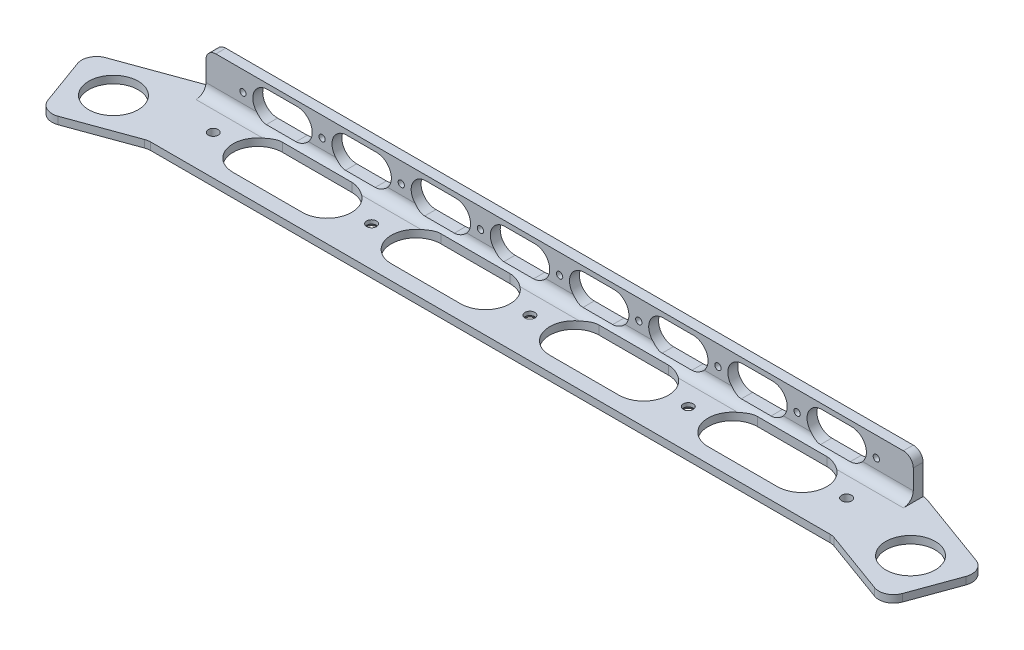
from build123d import *

# Parameters (mm, degrees)
BOSS_EXTRUDE1_DEPTH                                = 4.7752
SKETCH2_R                                          = 3.175
CUT_EXTRUDE1_DEPTH                                 = 291.109415024
SKETCH3_W                                          = 453.840971018
SKETCH3_H                                          = 6.35
BOSS_EXTRUDE2_DEPTH                                = 25.4
FILLET1_R                                          = 6.35
F_10_32_TAPPED_HOLE1_D                             = 4.0386
F_10_32_TAPPED_HOLE1_DEPTH                         = 66.771350159
LPATTERN1_COUNT                                    = 5
LPATTERN1_PITCH                                    = 50.8
LPATTERN1_COL_COUNT                                = 5
LPATTERN1_COL_PITCH                                = 50.8
CUT_EXTRUDE2_REACH                                 = 296.837
LPATTERN2_COUNT                                    = 8
LPATTERN2_PITCH                                    = 50.8
FILLET2_R                                          = 6.35
CUT_EXTRUDE3_REACH                                 = 293.635
SKETCH10_R                                         = 15.875
CSK_FOR_10_FLAT_HEAD_SOCKET_CAP_SCREW1_D           = 5.1054
CSK_FOR_10_FLAT_HEAD_SOCKET_CAP_SCREW1_CSINK_D     = 10.4394
CSK_FOR_10_FLAT_HEAD_SOCKET_CAP_SCREW1_CSINK_ANGLE = 82
CUT_EXTRUDE4_REACH                                 = 293.635
LPATTERN3_COUNT                                    = 4
LPATTERN3_PITCH                                    = 101.6


with BuildPart() as part:
    # Sketch1 → Boss-Extrude1 (new body)
    with BuildSketch(Plane(origin=(0, 0, 0), x_dir=(1, 0, 0), z_dir=(0, 1, 0))):
        with BuildLine():
            Line((-230.178227374, 50.225572213), (-279.319909207, 32.339462764))
            ThreePointArc((-279.319909207, 32.339462764), (-284.694749013, 27.414329494), (-285.012739555, 20.131148686))
            Line((-285.012739555, 20.131148686), (-274.153600004, -9.704092024))
            ThreePointArc((-274.153600004, -9.704092024), (-269.228466734, -15.07893183), (-261.945285926, -15.396922372))
            Line((-261.945285926, -15.396922372), (-221.220816754, -0.574427787))
            ThreePointArc((-221.220816754, -0.574427787), (-219.617073781, -0.144706153), (-217.963074889, 0))
            Line((-217.963074889, 0), (217.963074889, 0))
            ThreePointArc((217.963074889, 0), (219.617073781, -0.144706153), (221.220816754, -0.574427787))
            Line((221.220816754, -0.574427787), (261.945285926, -15.396922372))
            ThreePointArc((261.945285926, -15.396922372), (269.228466734, -15.07893183), (274.153600004, -9.704092024))
            Line((274.153600004, -9.704092024), (285.012739555, 20.131148686))
            ThreePointArc((285.012739555, 20.131148686), (284.694749013, 27.414329494), (279.319909207, 32.339462764))
            Line((279.319909207, 32.339462764), (230.178227374, 50.225572213))
            ThreePointArc((230.178227374, 50.225572213), (228.574484401, 50.655293847), (226.920485509, 50.8))
            Line((226.920485509, 50.8), (-226.920485509, 50.8))
            ThreePointArc((-226.920485509, 50.8), (-228.574484401, 50.655293847), (-230.178227374, 50.225572213))
        make_face()
    extrude(amount=BOSS_EXTRUDE1_DEPTH)

    # Sketch2 → Cut-Extrude1 (cut, through all)
    with BuildSketch(Plane(origin=(0, 4.7752, 0), x_dir=(1, 0, 0), z_dir=(0, 1, 0))):
        with Locations(Location((0, 25.4, 0), (0, 0, 270))):
            Circle(SKETCH2_R)
        with Locations(Location((-101.6, 25.4, 0), (0, 0, 270))):
            Circle(SKETCH2_R)
        with Locations(Location((101.6, 25.4, 0), (0, 0, 270))):
            Circle(SKETCH2_R)
        with Locations(Location((203.2, 25.4, 0), (0, 0, 270))):
            Circle(SKETCH2_R)
        with Locations(Location((-203.2, 25.4, 0), (0, 0, 270))):
            Circle(SKETCH2_R)
    extrude(amount=-CUT_EXTRUDE1_DEPTH, mode=Mode.SUBTRACT)

    # Sketch3 → Boss-Extrude2 (add)
    with BuildSketch(Plane(origin=(0, 4.7752, 0), x_dir=(1, 0, 0), z_dir=(0, 1, 0))):
        with Locations((0, 47.625)):
            Rectangle(SKETCH3_W, SKETCH3_H)
    extrude(amount=BOSS_EXTRUDE2_DEPTH)

    # Fillet1
    fillet1_edges = [part.edges().sort_by_distance(p)[0] for p in [
        (0, 4.7752, -44.45),
    ]]
    fillet(fillet1_edges, radius=FILLET1_R)

    # #10-32 Tapped Hole1
    with Locations(Plane(origin=(0, 0, -50.8), x_dir=(-1, 0, 0), z_dir=(0, 0, -1))):
        with Locations((0, 17.4625)):
            f_10_32_tapped_hole1 = Hole(F_10_32_TAPPED_HOLE1_D / 2, depth=F_10_32_TAPPED_HOLE1_DEPTH)

    # LPattern1: #10-32 Tapped Hole1 ×5
    with Locations(*[(-i * LPATTERN1_PITCH, 0, 0) for i in range(1, LPATTERN1_COUNT)]):
        add(f_10_32_tapped_hole1, mode=Mode.SUBTRACT)

    # LPattern1 col: #10-32 Tapped Hole1 ×5
    with Locations(*[(i * LPATTERN1_COL_PITCH, 0, 0) for i in range(1, LPATTERN1_COL_COUNT)]):
        add(f_10_32_tapped_hole1, mode=Mode.SUBTRACT)

    # Sketch9 → Cut-Extrude2 (cut, up to next)
    with BuildSketch(Plane(origin=(0, 0, -50.8), x_dir=(-1, 0, 0), z_dir=(0, 0, -1)), mode=Mode.PRIVATE) as cut_extrude2_sk1:
        with BuildLine():
            Line((168.275, 26.9875), (187.325, 26.9875))
            ThreePointArc((187.325, 26.9875), (196.85, 17.4625), (187.325, 7.9375))
            Line((187.325, 7.9375), (168.275, 7.9375))
            ThreePointArc((168.275, 7.9375), (158.75, 17.4625), (168.275, 26.9875))
        make_face()
    cut_extrude2_tool1 = extrude(cut_extrude2_sk1.sketch, amount=-CUT_EXTRUDE2_REACH, mode=Mode.PRIVATE) & part.part
    cut_extrude2 = cut_extrude2_tool1.solids().sort_by_distance((-177.8, 17.4625, -50.8))[0]
    add(cut_extrude2, mode=Mode.SUBTRACT)

    # LPattern2: Cut-Extrude2 ×8
    with Locations(*[(i * LPATTERN2_PITCH, 0, 0) for i in range(1, LPATTERN2_COUNT)]):
        add(cut_extrude2, mode=Mode.SUBTRACT)

    # Fillet2
    fillet2_edges = [part.edges().sort_by_distance(p)[0] for p in [
        (-226.920485509, 30.1752, -47.625),
        (226.920485509, 30.1752, -47.625),
    ]]
    fillet(fillet2_edges, radius=FILLET2_R)

    # Sketch10 → Cut-Extrude3 (cut, up to next)
    with BuildSketch(Plane.XZ, mode=Mode.PRIVATE) as cut_extrude3_sk1:
        with Locations(Location((-255.714977211, -13.900839971, 0), (0, 0, 270))):
            Circle(SKETCH10_R)
    cut_extrude3_tool1 = extrude(cut_extrude3_sk1.sketch, amount=-CUT_EXTRUDE3_REACH, mode=Mode.PRIVATE) & part.part
    # Sketch10 → Cut-Extrude3 (cut, up to next)
    with BuildSketch(Plane.XZ, mode=Mode.PRIVATE) as cut_extrude3_sk2:
        with Locations(Location((-174.625, -25.4, 0), (0, 0, 270))):
            Circle(SKETCH10_R)
    cut_extrude3_tool2 = extrude(cut_extrude3_sk2.sketch, amount=-CUT_EXTRUDE3_REACH, mode=Mode.PRIVATE) & part.part
    # Sketch10 → Cut-Extrude3 (cut, up to next)
    with BuildSketch(Plane.XZ, mode=Mode.PRIVATE) as cut_extrude3_sk3:
        with Locations(Location((-130.175, -25.4, 0), (0, 0, 270))):
            Circle(SKETCH10_R)
    cut_extrude3_tool3 = extrude(cut_extrude3_sk3.sketch, amount=-CUT_EXTRUDE3_REACH, mode=Mode.PRIVATE) & part.part
    # Sketch10 → Cut-Extrude3 (cut, up to next)
    with BuildSketch(Plane.XZ, mode=Mode.PRIVATE) as cut_extrude3_sk4:
        with Locations(Location((-28.575, -25.4, 0), (0, 0, 270))):
            Circle(SKETCH10_R)
    cut_extrude3_tool4 = extrude(cut_extrude3_sk4.sketch, amount=-CUT_EXTRUDE3_REACH, mode=Mode.PRIVATE) & part.part
    # Sketch10 → Cut-Extrude3 (cut, up to next)
    with BuildSketch(Plane.XZ, mode=Mode.PRIVATE) as cut_extrude3_sk5:
        with Locations(Location((-73.025, -25.4, 0), (0, 0, 270))):
            Circle(SKETCH10_R)
    cut_extrude3_tool5 = extrude(cut_extrude3_sk5.sketch, amount=-CUT_EXTRUDE3_REACH, mode=Mode.PRIVATE) & part.part
    cut_extrude3_1 = cut_extrude3_tool1.solids().sort_by_distance((-255.714977, 0, -13.90084))[0]
    add(cut_extrude3_1, mode=Mode.SUBTRACT)
    cut_extrude3_2 = cut_extrude3_tool2.solids().sort_by_distance((-174.625, 0, -25.4))[0]
    add(cut_extrude3_2, mode=Mode.SUBTRACT)
    cut_extrude3_3 = cut_extrude3_tool3.solids().sort_by_distance((-130.175, 0, -25.4))[0]
    add(cut_extrude3_3, mode=Mode.SUBTRACT)
    cut_extrude3_4 = cut_extrude3_tool4.solids().sort_by_distance((-28.575, 0, -25.4))[0]
    add(cut_extrude3_4, mode=Mode.SUBTRACT)
    cut_extrude3_5 = cut_extrude3_tool5.solids().sort_by_distance((-73.025, 0, -25.4))[0]
    add(cut_extrude3_5, mode=Mode.SUBTRACT)
    cut_extrude3 = cut_extrude3_1 + cut_extrude3_2 + cut_extrude3_3 + cut_extrude3_4 + cut_extrude3_5  # Cut-Extrude3 as one shape, for the pattern or mirror that repeats it

    # Mirror1: Cut-Extrude3 across plane
    add(cut_extrude3.mirror(Plane(origin=(0, 0, 0), x_dir=(0, 0, 1), z_dir=(1, 0, 0))), mode=Mode.SUBTRACT)

    # CSK for #10 Flat Head Socket Cap Screw1 (through all)
    with Locations(Plane.XZ):
        with Locations((101.6, -25.4), (0, -25.4), (-101.6, -25.4)):
            CounterSinkHole(CSK_FOR_10_FLAT_HEAD_SOCKET_CAP_SCREW1_D / 2, CSK_FOR_10_FLAT_HEAD_SOCKET_CAP_SCREW1_CSINK_D / 2, counter_sink_angle=CSK_FOR_10_FLAT_HEAD_SOCKET_CAP_SCREW1_CSINK_ANGLE)

    # Sketch17 → Cut-Extrude4 (cut, up to next)
    with BuildSketch(Plane.XZ, mode=Mode.PRIVATE) as cut_extrude4_sk1:
        with BuildLine():
            Line((-174.625, -9.525), (-130.175, -9.525))
            ThreePointArc((-130.175, -9.525), (-114.3, -25.4), (-130.175, -41.275))
            Line((-130.175, -41.275), (-174.625, -41.275))
            ThreePointArc((-174.625, -41.275), (-190.5, -25.4), (-174.625, -9.525))
        make_face()
    cut_extrude4_tool1 = extrude(cut_extrude4_sk1.sketch, amount=-CUT_EXTRUDE4_REACH, mode=Mode.PRIVATE) & part.part
    cut_extrude4 = cut_extrude4_tool1.solids().sort_by_distance((-152.4, 0, -25.4))[0]
    add(cut_extrude4, mode=Mode.SUBTRACT)

    # LPattern3: Cut-Extrude4 ×4
    with Locations(*[(i * LPATTERN3_PITCH, 0, 0) for i in range(1, LPATTERN3_COUNT)]):
        add(cut_extrude4, mode=Mode.SUBTRACT)


solid = part.part
